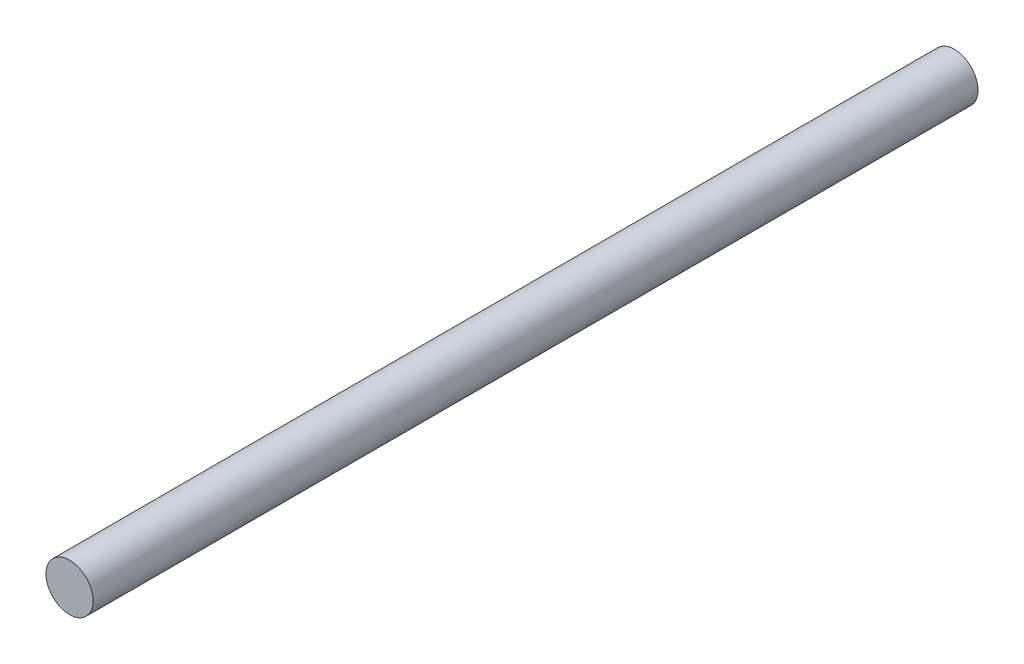
from build123d import *

# Parameters (mm, degrees)
SKETCH_1_R      = 4
EXTRUDE_1_DEPTH = 150


with BuildPart() as part:
    # Эскиз1 → Бобышка-Вытянуть1 (new body)
    with BuildSketch(Plane.XY):
        Circle(SKETCH_1_R)
    extrude(amount=EXTRUDE_1_DEPTH)


solid = part.part
